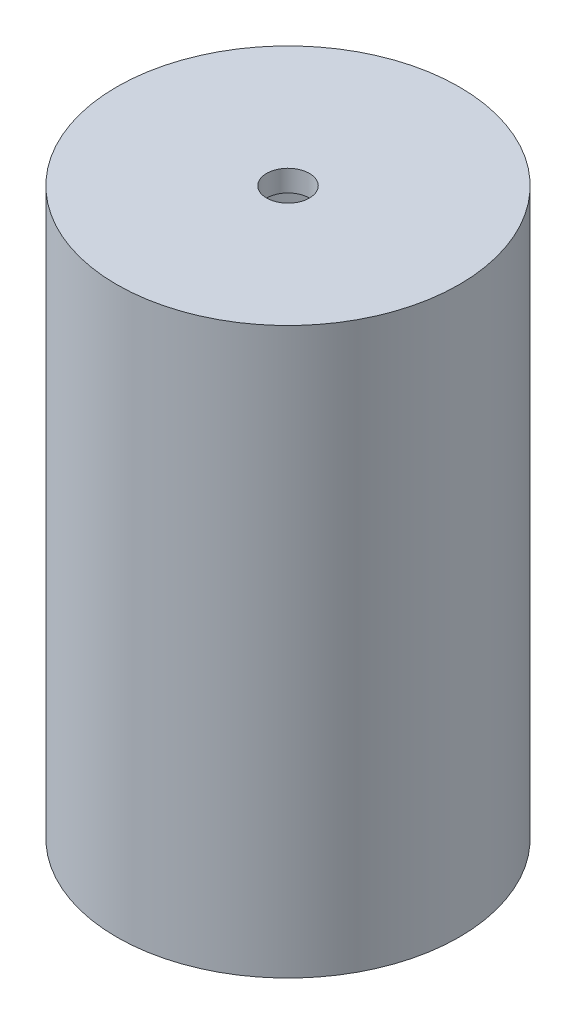
from build123d import *

# Parameters (mm, degrees)
SKETCH1_R           = 8
BOSS_EXTRUDE1_DEPTH = 26.4
SHELL7_T            = 1
SKETCH4_R           = 1
CUT_EXTRUDE1_DEPTH  = 3
SKETCH6_R           = 0.8
CUT_EXTRUDE2_DEPTH  = 6


with BuildPart() as part:
    # Sketch1 → Boss-Extrude1 (new body)
    with BuildSketch(Plane(origin=(0, 0, 0), x_dir=(1, 0, 0), z_dir=(0, 1, 0))):
        with Locations(Location((0, 0, 0), (0, 0, 270))):
            Circle(SKETCH1_R)
    extrude(amount=BOSS_EXTRUDE1_DEPTH)

    # Shell7 (no face opened: a closed hollow body)
    add(offset(amount=-SHELL7_T, mode=Mode.PRIVATE), mode=Mode.SUBTRACT)

    # Sketch4 → Cut-Extrude1 (cut)
    with BuildSketch(Plane(origin=(0, 26.4, 0), x_dir=(1, 0, 0), z_dir=(0, 1, 0))):
        with Locations(Location((0, 0, 0), (0, 0, 270))):
            Circle(SKETCH4_R)
    extrude(amount=-CUT_EXTRUDE1_DEPTH, mode=Mode.SUBTRACT)

    # Sketch6 → Cut-Extrude2 (cut)
    with BuildSketch(Plane.XZ):
        with Locations(Location((0, 0, 0), (0, 0, 270))):
            Circle(SKETCH6_R)
    extrude(amount=-CUT_EXTRUDE2_DEPTH, mode=Mode.SUBTRACT)


solid = part.part
